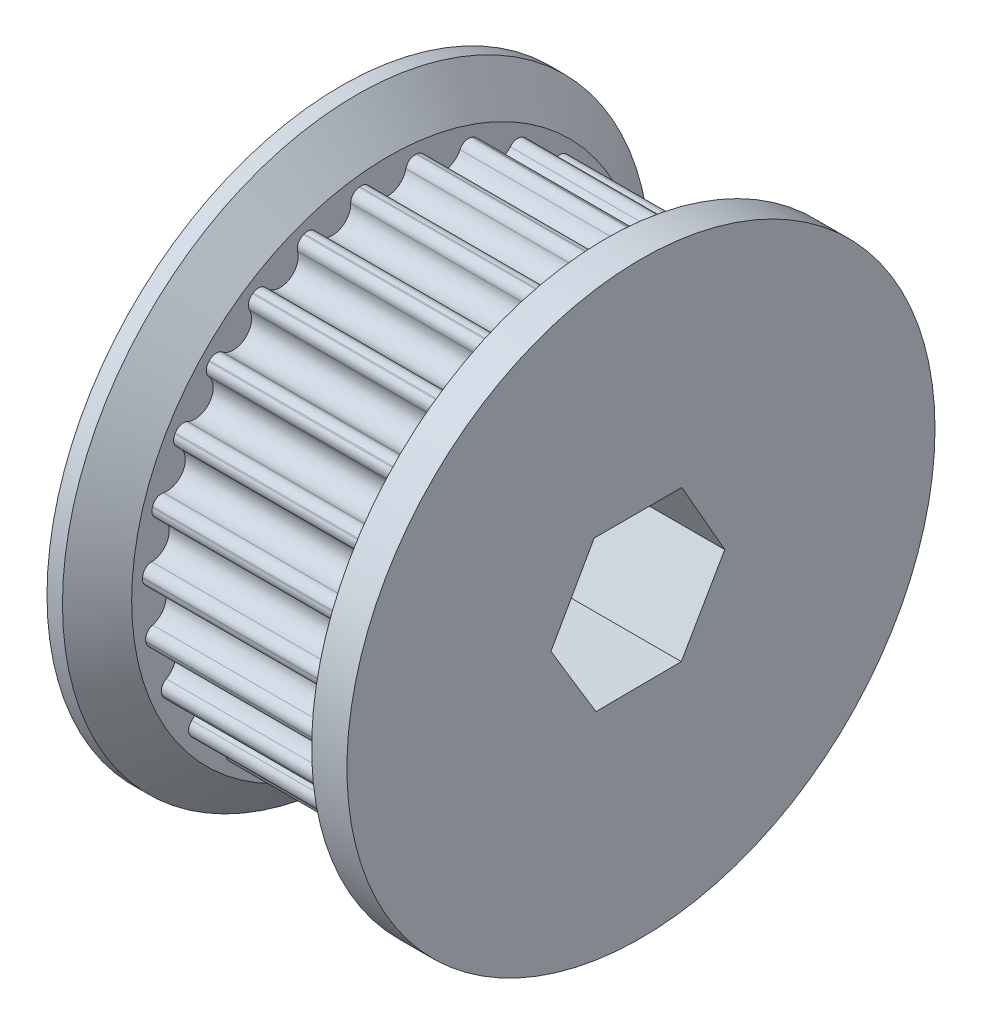
from build123d import *

# Parameters (mm, degrees)
SKETCH1_R                = 20.915
BOSS_EXTRUDE1_DEPTH      = 18.5
CUT_EXTRUDE6_START       = -43
CUT_EXTRUDE6_DEPTH       = 43
FILLET4_R                = 0.8
CIRPATTERN1_COUNT        = 27
FILLET4_OF_CIRPATTERN1_R = 0.8
SKETCH10_R               = 25
BOSS_EXTRUDE7_DEPTH      = 3
BOSS_EXTRUDE8_START      = 4
SKETCH11_R               = 25
BOSS_EXTRUDE8_DEPTH      = 4
CHAMFER1_SIZE            = 3.2
CHAMFER1_SIZE2           = 2.68511882
CUT_EXTRUDE5_DEPTH       = 42.379342793
CUT_EXTRUDE5_DEPTH_BACK  = 42.379342793


with BuildPart() as part:
    # Sketch1 → Boss-Extrude1 (new body)
    with BuildSketch(Plane(origin=(0, 0, 0), x_dir=(0, 0, -1), z_dir=(1, 0, 0))):
        Circle(SKETCH1_R)
    extrude(amount=BOSS_EXTRUDE1_DEPTH)

    # Sketch8 → Cut-Extrude6 (cut)
    with BuildSketch(Plane(origin=(18.5, 0, 0), x_dir=(0, 0, -1), z_dir=(1, 0, 0)).offset(CUT_EXTRUDE6_START)):
        with BuildLine():
            ThreePointArc((-1.488261256, 20.861982251), (0, 18.915), (1.488261256, 20.861982251))
            ThreePointArc((1.488261256, 20.861982251), (0, 20.915), (-1.488261256, 20.861982251))
        make_face()
    cut_extrude6 = extrude(amount=CUT_EXTRUDE6_DEPTH, mode=Mode.SUBTRACT)

    # Fillet4
    fillet4_edges = [part.edges().sort_by_distance(p)[0] for p in [
        (9.25, 20.861982251, 1.488261256),
        (9.25, 20.861982251, -1.488261256),
    ]]
    fillet(fillet4_edges, radius=FILLET4_R)

    # CirPattern1: Cut-Extrude6 ×27 about axis
    cirpattern1_axis = Axis((0, 0, 0), (1, 0, 0))
    for i in range(1, CIRPATTERN1_COUNT):
        add(cut_extrude6.rotate(cirpattern1_axis, i * 360 / CIRPATTERN1_COUNT), mode=Mode.SUBTRACT)

    # Fillet4 of CirPattern1
    fillet4_of_cirpattern1_edges = [part.edges().sort_by_distance(p)[0] for p in [
        (9.25, 19.956428154, 6.259249183),
        (9.25, 20.642861485, 3.362959221),
        (9.25, 17.97501785, 10.692799367),
        (9.25, 19.310878713, 8.032881696),
        (9.25, 15.02456968, 14.549897969),
        (9.25, 16.937841471, 12.269749439),
        (9.25, 11.264143071, 17.622607806),
        (9.25, 13.651680811, 15.845151815),
        (9.25, 6.896463593, 19.745278294),
        (9.25, 9.629554505, 18.566337954),
        (9.25, 2.156993977, 20.803475719),
        (9.25, 5.088296424, 20.286608009),
        (9.25, -2.698759742, 20.740152383),
        (9.25, 0.272726965, 20.913221775),
        (9.25, -7.409022625, 19.558722063),
        (9.25, -4.557545276, 20.412398342),
        (9.25, -11.719863181, 17.322875975),
        (9.25, -9.14211907, 18.81113723),
        (9.25, -15.398882878, 14.153149158),
        (9.25, -13.23383886, 16.195762842),
        (9.25, -18.247744814, 10.220422408),
        (9.25, -16.612118971, 12.707270687),
        (9.25, -20.112866104, 5.73671004),
        (9.25, -19.094835448, 8.533726279),
        (9.25, -20.893697576, 0.943730148),
        (9.25, -20.548144404, 3.90012648),
        (9.25, -20.548144404, -3.90012648),
        (9.25, -20.893697576, -0.943730148),
        (9.25, -19.094835448, -8.533726279),
        (9.25, -20.112866104, -5.73671004),
        (9.25, -16.612118971, -12.707270687),
        (9.25, -18.247744814, -10.220422408),
        (9.25, -13.23383886, -16.195762842),
        (9.25, -15.398882878, -14.153149158),
        (9.25, -9.14211907, -18.81113723),
        (9.25, -11.719863181, -17.322875975),
        (9.25, -4.557545276, -20.412398342),
        (9.25, -7.409022625, -19.558722063),
        (9.25, 0.272726965, -20.913221775),
        (9.25, -2.698759742, -20.740152383),
        (9.25, 5.088296424, -20.286608009),
        (9.25, 2.156993977, -20.803475719),
        (9.25, 9.629554505, -18.566337954),
        (9.25, 6.896463593, -19.745278294),
        (9.25, 13.651680811, -15.845151815),
        (9.25, 11.264143071, -17.622607806),
        (9.25, 16.937841471, -12.269749439),
        (9.25, 15.02456968, -14.549897969),
        (9.25, 19.310878713, -8.032881696),
        (9.25, 17.97501785, -10.692799367),
        (9.25, 20.642861485, -3.362959221),
        (9.25, 19.956428154, -6.259249183),
    ]]
    fillet(fillet4_of_cirpattern1_edges, radius=FILLET4_OF_CIRPATTERN1_R)

    # Sketch10 → Boss-Extrude7 (add)
    with BuildSketch(Plane(origin=(18.5, 0, 0), x_dir=(0, 0, -1), z_dir=(1, 0, 0))):
        Circle(SKETCH10_R)
    extrude(amount=BOSS_EXTRUDE7_DEPTH)

    # Sketch11 → Boss-Extrude8 (add)
    with BuildSketch(Plane.ZY.offset(BOSS_EXTRUDE8_START)):
        with Locations(Location((0, 0, 0), (0, 0, 180))):
            Circle(SKETCH11_R)
    extrude(amount=-BOSS_EXTRUDE8_DEPTH)

    # Chamfer1
    chamfer1_edges = [part.edges().sort_by_distance(p)[0] for p in [
        (0, 0, 25),
    ]]
    chamfer1_side = [part.faces().sort_by_distance(p)[0] for p in [
        (0, 0, 24.292893216),
    ]]
    chamfer(chamfer1_edges, length=CHAMFER1_SIZE, length2=CHAMFER1_SIZE2, reference=chamfer1_side[0])

    # Sketch9 → Cut-Extrude5 (cut, two sides: drawn at the far end of the back side and taken through both)
    with BuildSketch(Plane.ZY.offset(-CUT_EXTRUDE5_DEPTH_BACK)):
        Polygon((-3.471061286, 6.444457654), (-7.125456531, 0.043657654), (-3.429837967, -6.357142346), (3.826782025, -6.409720657), (7.655941161, -0.063516257), (3.981752634, 6.444457654), align=None)
    extrude(amount=CUT_EXTRUDE5_DEPTH + CUT_EXTRUDE5_DEPTH_BACK, mode=Mode.SUBTRACT)


solid = part.part
